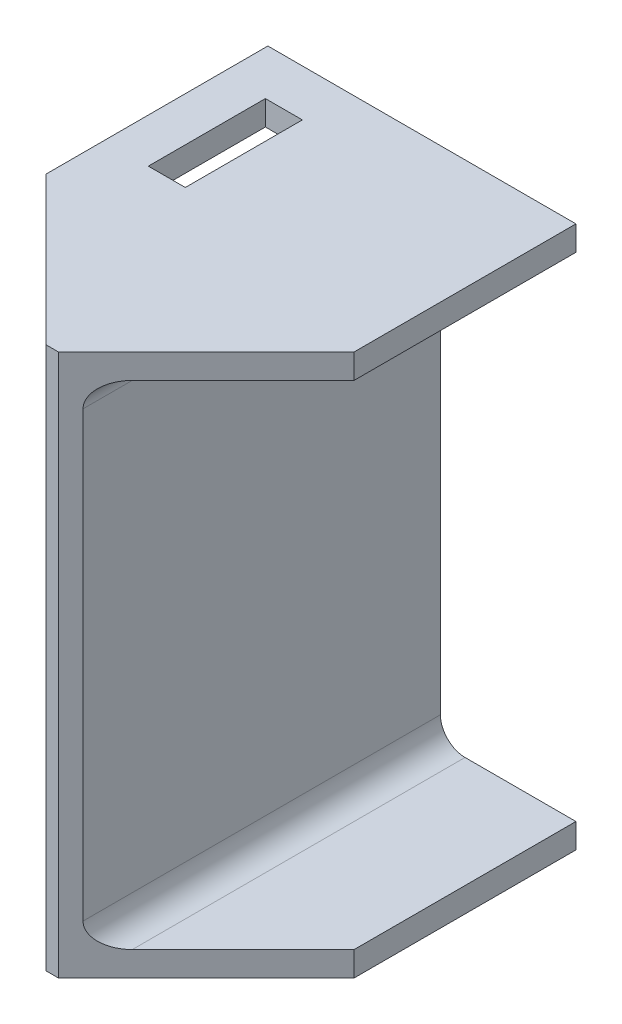
from build123d import *

# Parameters (mm, degrees)
BOSS_EXTRUDE1_DEPTH = 30
CHAMFER1_SIZE       = 12
FILLET1_R           = 2
SKETCH2_W           = 3
SKETCH2_H           = 9.5
CUT_EXTRUDE1_DEPTH  = 30


with BuildPart() as part:
    # Sketch1 → Boss-Extrude1 (new body)
    with BuildSketch(Plane.XY):
        Polygon((6.861356932, 34.926253687), (17.861356932, 34.926253687), (17.861356932, 36.926253687), (-7.138643068, 36.926253687), (-7.138643068, 34.926253687), (3.861356932, 34.926253687), (3.861356932, -5.073746313), (-7.138643068, -5.073746313), (-7.138643068, -7.073746313), (17.861356932, -7.073746313), (17.861356932, -5.073746313), (6.861356932, -5.073746313), align=None)
    extrude(amount=BOSS_EXTRUDE1_DEPTH)

    # Chamfer1
    chamfer1_edges = [part.edges().sort_by_distance(p)[0] for p in [
        (-7.138643068, 35.926253687, 30),
        (17.861356932, 35.926253687, 30),
    ]]
    chamfer(chamfer1_edges, length=CHAMFER1_SIZE)

    # Fillet1
    fillet1_edges = [part.edges().sort_by_distance(p)[0] for p in [
        (3.861356932, -5.073746313, 14.5),
        (3.861356932, 34.926253687, 14.5),
        (6.861356932, 34.926253687, 14.5),
        (6.861356932, -5.073746313, 14.5),
    ]]
    fillet(fillet1_edges, radius=FILLET1_R)

    # Sketch2 → Cut-Extrude1 (cut)
    with BuildSketch(Plane(origin=(0, 36.926253687, 0), x_dir=(1, 0, 0), z_dir=(0, 1, 0))):
        with Locations((-2.045453442, -8.544505852)):
            Rectangle(SKETCH2_W, SKETCH2_H)
    extrude(amount=-CUT_EXTRUDE1_DEPTH, mode=Mode.SUBTRACT)


solid = part.part
